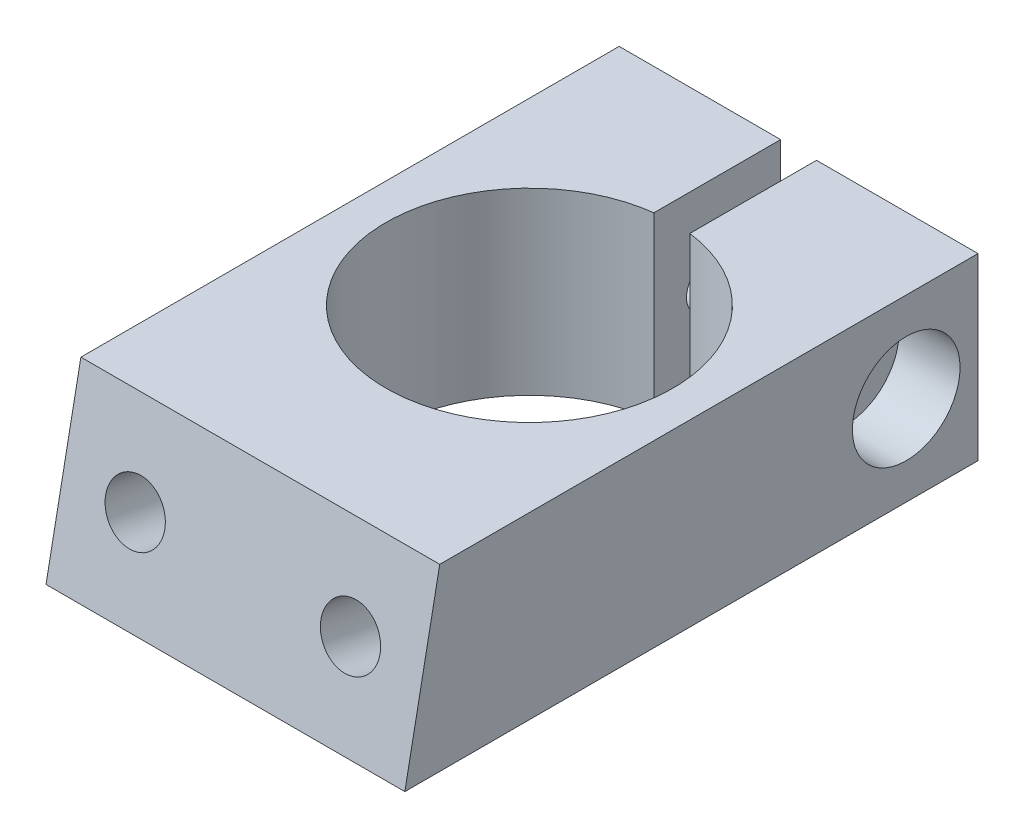
from build123d import *

# Parameters (mm, degrees)
EXTRUDE_1_DEPTH           = 10
CUT_EXTRUDE_1_DEPTH       = 35.93431774
HOLE_WIZARD_M4_1_D        = 3.3
HOLE_WIZARD_M4_1_DEPTH    = 9.5
HOLE_WIZARD_M4_1_TIP      = 0.991420021
HOLE_WIZARD_2_D           = 3.2
HOLE_WIZARD_2_DEPTH       = 10
HOLE_WIZARD_2_CBORE_D     = 6
HOLE_WIZARD_2_CBORE_DEPTH = 3.4
HOLE_WIZARD_2_TIP         = 0.96137699
HOLE_WIZARD_M3_1_D        = 2.5


with BuildPart() as part:
    # 草图1 → 凸台-拉伸1 (new, symmetric)
    with BuildSketch(Plane(origin=(0, 0, 0), x_dir=(0, 0, -1), z_dir=(1, 0, 0))):
        Polygon((0, 0), (1.943803091, 10), (31.943803091, 10), (31.943803091, 0), align=None)
    extrude(amount=EXTRUDE_1_DEPTH, both=True)

    # 草图2 → 切除-拉伸1 (cut, through all)
    with BuildSketch(Plane(origin=(0, 10, 0), x_dir=(1, 0, 0), z_dir=(0, 1, 0))):
        with BuildLine():
            Line((-1, 31.943803091), (1, 31.943803091))
            Line((1, 31.943803091), (1, 24.881057025))
            ThreePointArc((1, 24.881057025), (0, 8.943803091), (-1, 24.881057025))
            Line((-1, 24.881057025), (-1, 31.943803091))
        make_face()
    extrude(amount=-CUT_EXTRUDE_1_DEPTH, mode=Mode.SUBTRACT)

    # M4 螺纹孔1
    with Locations(Plane(origin=(0, 0, 0), x_dir=(1, 0, 0), z_dir=(0, 0.19080899537654164, 0.9816271834476646))):
        with Locations((-6, 5.093583475), (6, 5.093583475)):
            Hole(HOLE_WIZARD_M4_1_D / 2, depth=HOLE_WIZARD_M4_1_DEPTH)
            with Locations((0, 0, -(HOLE_WIZARD_M4_1_DEPTH + HOLE_WIZARD_M4_1_TIP / 2))):  # 118° drill point
                Cone(0, HOLE_WIZARD_M4_1_D / 2, HOLE_WIZARD_M4_1_TIP, mode=Mode.SUBTRACT)

    # 打孔尺寸(%根据)内六角圆柱头螺钉的类型2
    with Locations(Plane(origin=(10, 0, 0), x_dir=(0, 0, -1), z_dir=(1, 0, 0))):
        with Locations((27.943803091, 5)):
            CounterBoreHole(HOLE_WIZARD_2_D / 2, HOLE_WIZARD_2_CBORE_D / 2, HOLE_WIZARD_2_CBORE_DEPTH, depth=HOLE_WIZARD_2_DEPTH)
            with Locations((0, 0, -(HOLE_WIZARD_2_DEPTH + HOLE_WIZARD_2_TIP / 2))):  # 118° drill point
                Cone(0, HOLE_WIZARD_2_D / 2, HOLE_WIZARD_2_TIP, mode=Mode.SUBTRACT)

    # M3 螺纹孔1 (through all)
    with Locations(Plane.ZY.offset(10)):
        with Locations((-27.943803091, 5)):
            Hole(HOLE_WIZARD_M3_1_D / 2)


solid = part.part
